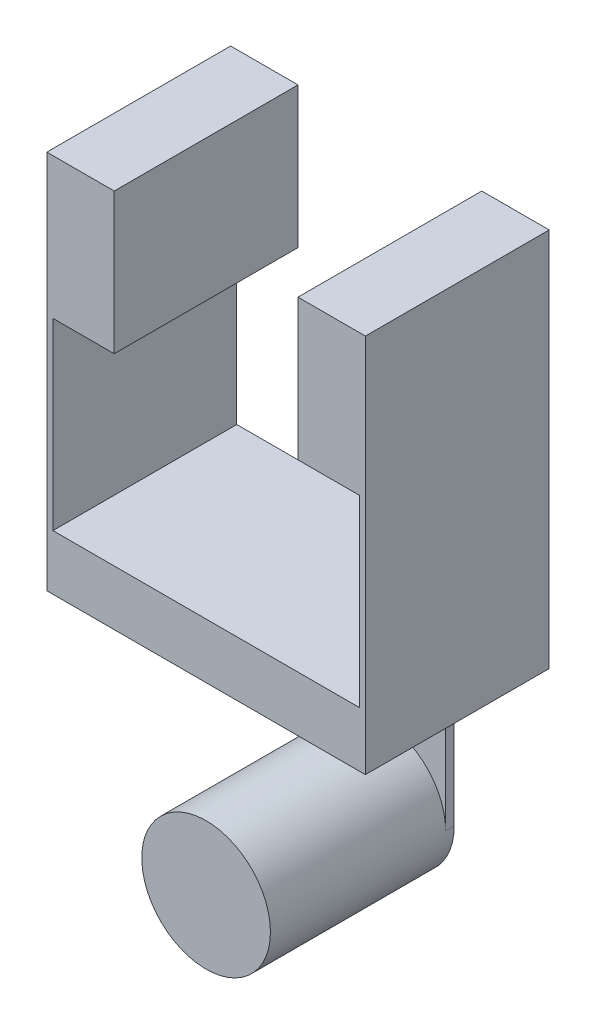
from build123d import *

# Parameters (mm, degrees)
SKETCH1_R           = 13.335
FEATUREA_DEPTH      = 38.1
SKETCH2_W           = 26.67
SKETCH2_H           = 38.1
FEATUREB_DEPTH      = 1.778
FEATUREC_DEPTH      = 11.43
SKETCH4_W           = 1.27
SKETCH4_H           = 38.1
FEATURED_DEPTH      = 38.1
SKETCH7_W           = 13.97
SKETCH7_H           = 38.1
BOSS_EXTRUDE5_DEPTH = 29.21


with BuildPart() as part:
    # Sketch1 → FeatureA (new body)
    with BuildSketch(Plane.XY):
        Circle(SKETCH1_R)
    extrude(amount=-FEATUREA_DEPTH)

    # Sketch2 → FeatureB (add)
    with BuildSketch(Plane(origin=(0, 0, -38.1), x_dir=(-1, 0, 0), z_dir=(0, 0, -1))):
        with Locations((0, 19.05)):
            Rectangle(SKETCH2_W, SKETCH2_H)
    extrude(amount=-FEATUREB_DEPTH)

    # Sketch3 → FeatureC (add)
    with BuildSketch(Plane(origin=(0, 38.1, 0), x_dir=(1, 0, 0), z_dir=(0, 1, 0))):
        Polygon((0, 38.1), (-33.02, 38.1), (-33.02, 0), (33.02, 0), (33.02, 38.1), align=None)
    extrude(amount=FEATUREC_DEPTH)

    # Sketch4 → FeatureD (add)
    with BuildSketch(Plane(origin=(0, 49.53, 0), x_dir=(1, 0, 0), z_dir=(0, 1, 0))):
        with Locations((32.385, 19.05)):
            Rectangle(SKETCH4_W, SKETCH4_H)
        with Locations((-32.385, 19.05)):
            Rectangle(SKETCH4_W, SKETCH4_H)
    extrude(amount=FEATURED_DEPTH)

    # Sketch7 → Boss-Extrude5 (add)
    with BuildSketch(Plane(origin=(0, 87.63, 0), x_dir=(1, 0, 0), z_dir=(0, 1, 0))):
        with Locations((26.035, 19.05)):
            Rectangle(SKETCH7_W, SKETCH7_H)
        with Locations((-26.035, 19.05)):
            Rectangle(SKETCH7_W, SKETCH7_H)
    extrude(amount=BOSS_EXTRUDE5_DEPTH)


solid = part.part
